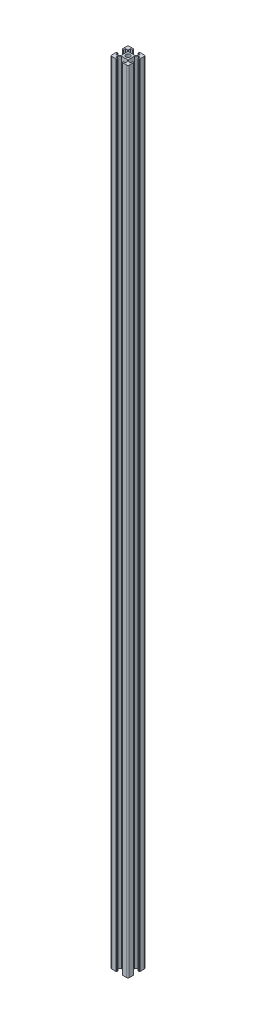
from build123d import *

# Parameters (mm, degrees)
BOSS_EXTRUDE1_DEPTH = 900
SKETCH3_R           = 2.5
CUT_EXTRUDE1_DEPTH  = 901.111104253
CIRPATTERN1_COUNT   = 4


with BuildPart() as part:
    # Sketch2 → Boss-Extrude1 (new body)
    with BuildSketch(Plane(origin=(0, 0, 0), x_dir=(1, 0, 0), z_dir=(0, 1, 0))):
        with BuildLine():
            Line((-10, -8.5), (-10, 8.5))
            ThreePointArc((-10, 8.5), (-9.560660172, 9.560660172), (-8.5, 10))
            Line((-8.5, 10), (8.5, 10))
            ThreePointArc((8.5, 10), (9.560660172, 9.560660172), (10, 8.5))
            Line((10, 8.5), (10, -8.5))
            ThreePointArc((10, -8.5), (9.560660172, -9.560660172), (8.5, -10))
            Line((8.5, -10), (-8.5, -10))
            ThreePointArc((-8.5, -10), (-9.560660172, -9.560660172), (-10, -8.5))
        make_face()
    extrude(amount=BOSS_EXTRUDE1_DEPTH)

    # Sketch3 → Cut-Extrude1 (cut, through all)
    with BuildSketch(Plane(origin=(0, 900, 0), x_dir=(1, 0, 0), z_dir=(0, 1, 0))):
        with BuildLine():
            Line((-6.348528137, -5.5), (-4.2, -3.351471863))
            Line((-4.2, -3.351471863), (-4.2, 3.351471863))
            Line((-4.2, 3.351471863), (-6.348528137, 5.5))
            Line((-6.348528137, 5.5), (-8.5, 5.5))
            Line((-8.5, 5.5), (-8.5, 3.1))
            Line((-8.5, 3.1), (-9.3, 3.1))
            ThreePointArc((-9.3, 3.1), (-9.441421356, 3.158578644), (-9.5, 3.3))
            Line((-9.5, 3.3), (-9.5, 3.6))
            Line((-9.5, 3.6), (-9.8, 3.6))
            ThreePointArc((-9.8, 3.6), (-9.941421356, 3.658578644), (-10, 3.8))
            Line((-10, 3.8), (-10, -3.8))
            ThreePointArc((-10, -3.8), (-9.941421356, -3.658578644), (-9.8, -3.6))
            Line((-9.8, -3.6), (-9.5, -3.6))
            Line((-9.5, -3.6), (-9.5, -3.3))
            ThreePointArc((-9.5, -3.3), (-9.441421356, -3.158578644), (-9.3, -3.1))
            Line((-9.3, -3.1), (-8.5, -3.1))
            Line((-8.5, -3.1), (-8.5, -5.5))
            Line((-8.5, -5.5), (-6.348528137, -5.5))
        make_face()
        Circle(SKETCH3_R)
    cut_extrude1 = extrude(amount=-CUT_EXTRUDE1_DEPTH, mode=Mode.SUBTRACT)

    # CirPattern1: Cut-Extrude1 ×4 about axis
    cirpattern1_axis = Axis((0, -20, 0), (0, 1, 0))
    for i in range(1, CIRPATTERN1_COUNT):
        add(cut_extrude1.rotate(cirpattern1_axis, i * 360 / CIRPATTERN1_COUNT), mode=Mode.SUBTRACT)


solid = part.part
